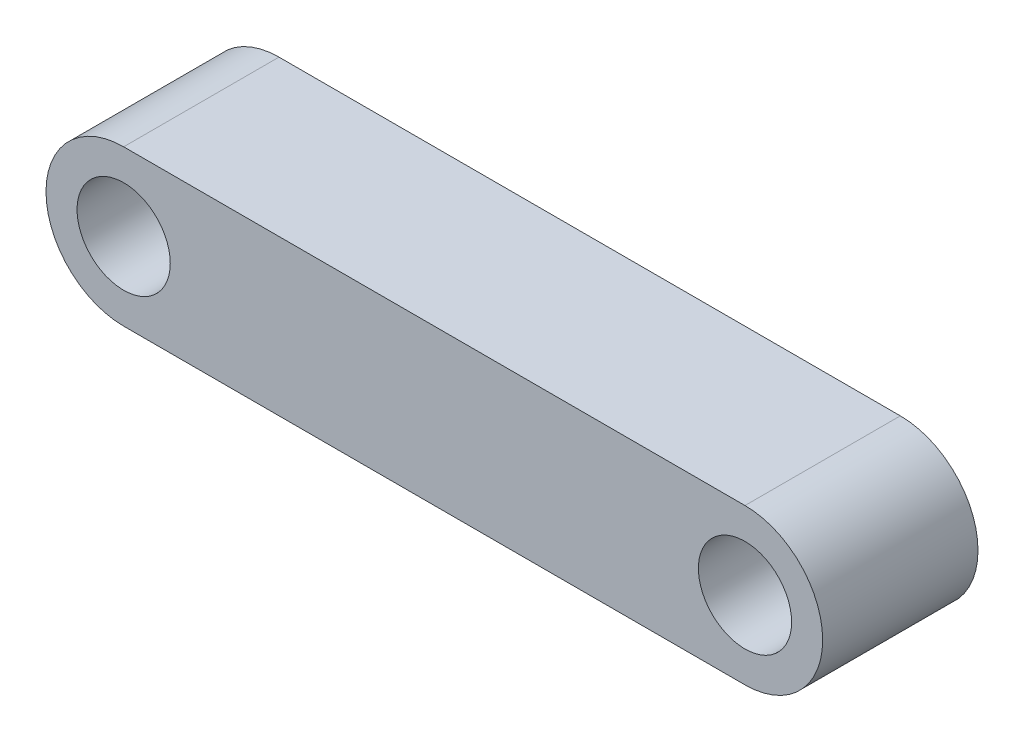
from build123d import *

# Parameters (mm, degrees)
BOSS_EXTRUDE1_DEPTH = 20
SKETCH2_R           = 6
CUT_EXTRUDE1_DEPTH  = 55.772255751


with BuildPart() as part:
    # Sketch1 → Boss-Extrude1 (new body)
    with BuildSketch(Plane.XY):
        with BuildLine():
            Line((40, -10), (-40, -10))
            ThreePointArc((-40, -10), (-50, 0), (-40, 10))
            Line((-40, 10), (40, 10))
            ThreePointArc((40, 10), (50, 0), (40, -10))
        make_face()
    extrude(amount=BOSS_EXTRUDE1_DEPTH)

    # Sketch2 → Cut-Extrude1 (cut, through all)
    with BuildSketch(Plane.XY.offset(20)):
        with Locations((-40, 0)):
            Circle(SKETCH2_R)
        with Locations((40, 0)):
            Circle(SKETCH2_R)
    extrude(amount=-CUT_EXTRUDE1_DEPTH, mode=Mode.SUBTRACT)


solid = part.part
